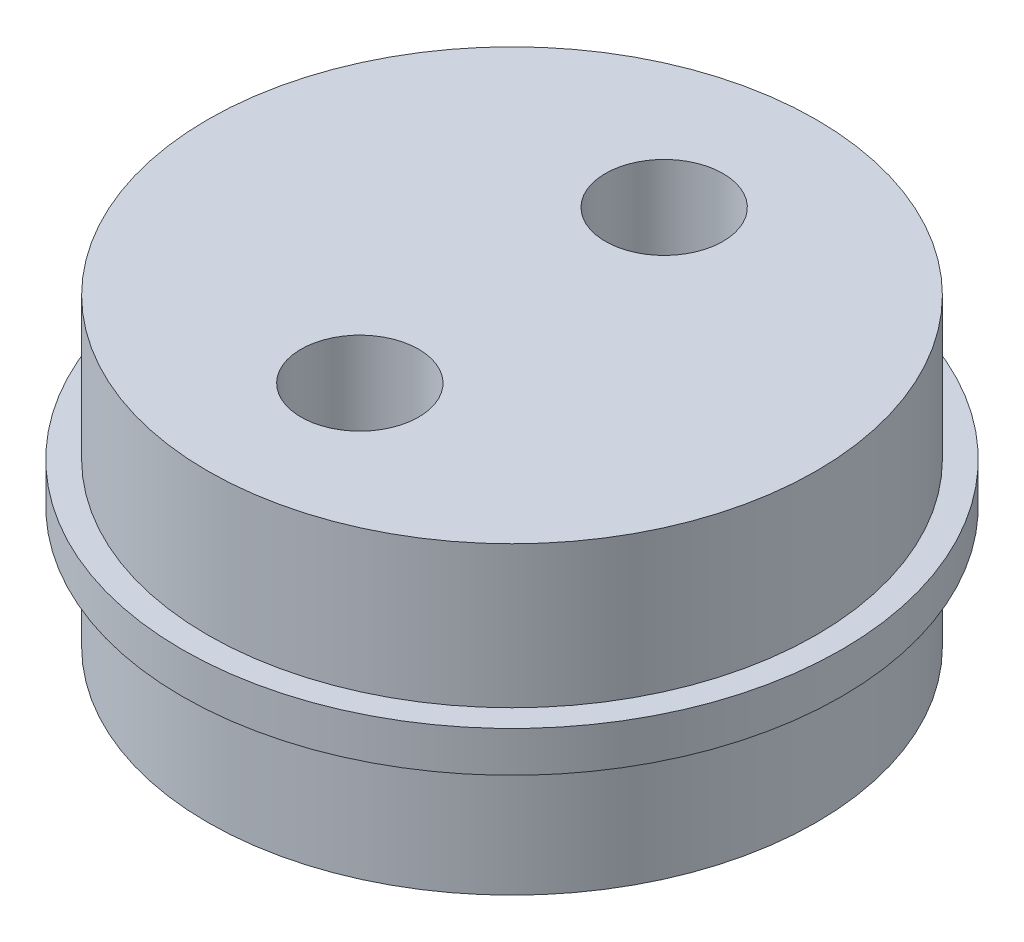
from build123d import *

# Parameters (mm, degrees)
SKETCH1_R               = 16.25
BOSS_EXTRUDE1_DEPTH     = 2
SKETCH2_R               = 15
BOSS_EXTRUDE2_DEPTH     = 6
BOSS_EXTRUDE3_START     = 7
SKETCH3_R               = 15
BOSS_EXTRUDE3_DEPTH     = 7
CUT_EXTRUDE1_DEPTH      = 28.443123
CUT_EXTRUDE1_DEPTH_BACK = 8
SKETCH4_R               = 2.9
CUT_EXTRUDE2_DEPTH      = 25.33361872
CUT_EXTRUDE2_DEPTH_BACK = 25.33361872
SKETCH5_R               = 2.2


with BuildPart() as part:
    # Sketch1 → Boss-Extrude1 (new body)
    with BuildSketch(Plane(origin=(0, 0, 0), x_dir=(1, 0, 0), z_dir=(0, 1, 0))):
        with Locations(Location((0, 0, 0), (0, 0, 270))):
            Circle(SKETCH1_R)
    extrude(amount=BOSS_EXTRUDE1_DEPTH)

    # Sketch2 → Boss-Extrude2 (add)
    with BuildSketch(Plane.XZ):
        with Locations(Location((0, 0, 0), (0, 0, 270))):
            Circle(SKETCH2_R)
    extrude(amount=BOSS_EXTRUDE2_DEPTH)

    # Sketch3 → Boss-Extrude3 (add)
    with BuildSketch(Plane(origin=(0, 2, 0), x_dir=(1, 0, 0), z_dir=(0, 1, 0)).offset(BOSS_EXTRUDE3_START)):
        with Locations(Location((0, 0, 0), (0, 0, 90))):
            Circle(SKETCH3_R)
    extrude(amount=-BOSS_EXTRUDE3_DEPTH)

    # Sketch4 → Cut-Extrude1 (cut, two sides: drawn at the far end of the back side and taken through both)
    with BuildSketch(Plane(origin=(0, 9, 0), x_dir=(1, 0, 0), z_dir=(0, 1, 0)).offset(-CUT_EXTRUDE1_DEPTH_BACK)):
        with Locations(Location((0, 7.5, 0), (0, 0, 90))):
            Circle(SKETCH4_R)
        with Locations(Location((0, -7.5, 0), (0, 0, 90))):
            Circle(SKETCH4_R)
    extrude(amount=CUT_EXTRUDE1_DEPTH + CUT_EXTRUDE1_DEPTH_BACK, mode=Mode.SUBTRACT)

    # Sketch5 → Cut-Extrude2 (cut, two sides: drawn at the far end of the back side and taken through both)
    with BuildSketch(Plane(origin=(0, 1, 0), x_dir=(1, 0, 0), z_dir=(0, 1, 0)).offset(-CUT_EXTRUDE2_DEPTH_BACK)):
        with Locations(Location((0, 7.5, 0), (0, 0, 270))):
            Circle(SKETCH5_R)
        with Locations(Location((0, -7.5, 0), (0, 0, 270))):
            Circle(SKETCH5_R)
    extrude(amount=CUT_EXTRUDE2_DEPTH + CUT_EXTRUDE2_DEPTH_BACK, mode=Mode.SUBTRACT)


solid = part.part
